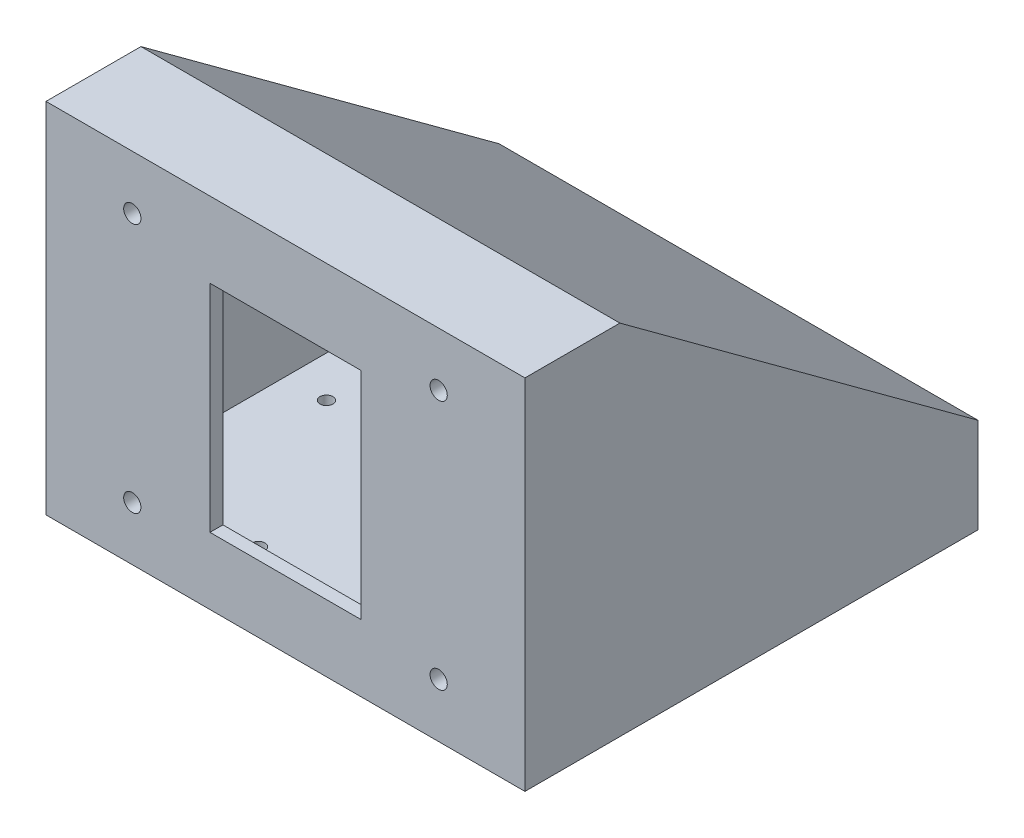
from build123d import *

# Parameters (mm, degrees)
SKETCH1_W           = 210
SKETCH1_H           = 210
SKETCH1_R           = 3
BOSS_EXTRUDE1_DEPTH = 6
SKETCH3_W           = 210
SKETCH3_H           = 6
BOSS_EXTRUDE2_DEPTH = 160
BOSS_EXTRUDE4_DEPTH = 6
BOSS_EXTRUDE5_START = -210
BOSS_EXTRUDE5_DEPTH = 6
SKETCH6_W           = 70
SKETCH6_H           = 100
CUT_EXTRUDE1_DEPTH  = 341.335128954
SKETCH7_W           = 210
SKETCH7_H           = 38
BOSS_EXTRUDE6_DEPTH = 6
SKETCH8_W           = 222
SKETCH8_H           = 206.009708509
BOSS_EXTRUDE7_DEPTH = 6
SKETCH9_W           = 222
SKETCH9_H           = 44
BOSS_EXTRUDE8_DEPTH = 6
CUT_EXTRUDE2_REACH  = 345.965
SKETCH10_R          = 4


with BuildPart() as part:
    # Sketch1 → Boss-Extrude1 (new body)
    with BuildSketch(Plane(origin=(0, 0, 0), x_dir=(1, 0, 0), z_dir=(0, 1, 0))):
        with Locations((105, 105)):
            Rectangle(SKETCH1_W, SKETCH1_H)
        with Locations((62, 179.478184725)):
            Circle(SKETCH1_R, mode=Mode.SUBTRACT)
        with Locations((148, 179.478184725)):
            Circle(SKETCH1_R, mode=Mode.SUBTRACT)
        with Locations((191, 105)):
            Circle(SKETCH1_R, mode=Mode.SUBTRACT)
        with Locations((148, 30.521815275)):
            Circle(SKETCH1_R, mode=Mode.SUBTRACT)
        with Locations((62, 30.521815275)):
            Circle(SKETCH1_R, mode=Mode.SUBTRACT)
        with Locations((19, 105)):
            Circle(SKETCH1_R, mode=Mode.SUBTRACT)
    extrude(amount=BOSS_EXTRUDE1_DEPTH)

    # Sketch3 → Boss-Extrude2 (add)
    with BuildSketch(Plane(origin=(0, 6, 0), x_dir=(1, 0, 0), z_dir=(0, 1, 0))):
        with Locations((105, 3)):
            Rectangle(SKETCH3_W, SKETCH3_H)
    extrude(amount=BOSS_EXTRUDE2_DEPTH)

    # Sketch4 → Boss-Extrude4 (add)
    with BuildSketch(Plane.ZY):
        Polygon((0, 0), (-210, 0), (-210, 44), (-44, 166), (0, 166), align=None)
    extrude(amount=BOSS_EXTRUDE4_DEPTH)

    # Sketch4<3> → Boss-Extrude5 (add)
    with BuildSketch(Plane.ZY.offset(BOSS_EXTRUDE5_START)):
        Polygon((0, 0), (-210, 0), (-210, 44), (-44, 166), (0, 166), align=None)
    extrude(amount=-BOSS_EXTRUDE5_DEPTH)

    # Sketch6 → Cut-Extrude1 (cut, through all)
    with BuildSketch(Plane(origin=(0, 0, -6), x_dir=(-1, 0, 0), z_dir=(0, 0, -1))):
        with Locations((-105, 81)):
            Rectangle(SKETCH6_W, SKETCH6_H)
    extrude(amount=-CUT_EXTRUDE1_DEPTH, mode=Mode.SUBTRACT)

    # Sketch7 → Boss-Extrude6 (add)
    with BuildSketch(Plane(origin=(0, 0, -210), x_dir=(-1, 0, 0), z_dir=(0, 0, -1))):
        with Locations((-105, 25)):
            Rectangle(SKETCH7_W, SKETCH7_H)
    extrude(amount=-BOSS_EXTRUDE6_DEPTH)

    # Sketch8 → Boss-Extrude7 (add)
    with BuildSketch(Plane(origin=(0, 128.779076343, -94.644863336), x_dir=(1, 0, 0), z_dir=(0, 0.8057872670242422, -0.5922050998611905))):
        with Locations((105, 40.153447427)):
            Rectangle(SKETCH8_W, SKETCH8_H)
    extrude(amount=-BOSS_EXTRUDE7_DEPTH)

    # Sketch9 → Boss-Extrude8 (add)
    with BuildSketch(Plane(origin=(0, 166, 0), x_dir=(1, 0, 0), z_dir=(0, 1, 0))):
        with Locations((105, 22)):
            Rectangle(SKETCH9_W, SKETCH9_H)
    extrude(amount=-BOSS_EXTRUDE8_DEPTH)

    # Sketch10 → Cut-Extrude2 (cut, up to next)
    with BuildSketch(Plane.XY, mode=Mode.PRIVATE) as cut_extrude2_sk1:
        with Locations((176, 141)):
            Circle(SKETCH10_R)
    cut_extrude2_tool1 = extrude(cut_extrude2_sk1.sketch, amount=-CUT_EXTRUDE2_REACH, mode=Mode.PRIVATE) & part.part
    # Sketch10 → Cut-Extrude2 (cut, up to next)
    with BuildSketch(Plane.XY, mode=Mode.PRIVATE) as cut_extrude2_sk2:
        with Locations((34, 141)):
            Circle(SKETCH10_R)
    cut_extrude2_tool2 = extrude(cut_extrude2_sk2.sketch, amount=-CUT_EXTRUDE2_REACH, mode=Mode.PRIVATE) & part.part
    # Sketch10 → Cut-Extrude2 (cut, up to next)
    with BuildSketch(Plane.XY, mode=Mode.PRIVATE) as cut_extrude2_sk3:
        with Locations((34, 25)):
            Circle(SKETCH10_R)
    cut_extrude2_tool3 = extrude(cut_extrude2_sk3.sketch, amount=-CUT_EXTRUDE2_REACH, mode=Mode.PRIVATE) & part.part
    # Sketch10 → Cut-Extrude2 (cut, up to next)
    with BuildSketch(Plane.XY, mode=Mode.PRIVATE) as cut_extrude2_sk4:
        with Locations((176, 25)):
            Circle(SKETCH10_R)
    cut_extrude2_tool4 = extrude(cut_extrude2_sk4.sketch, amount=-CUT_EXTRUDE2_REACH, mode=Mode.PRIVATE) & part.part
    add(cut_extrude2_tool1.solids().sort_by_distance((176, 141, 0))[0], mode=Mode.SUBTRACT)
    add(cut_extrude2_tool2.solids().sort_by_distance((34, 141, 0))[0], mode=Mode.SUBTRACT)
    add(cut_extrude2_tool3.solids().sort_by_distance((34, 25, 0))[0], mode=Mode.SUBTRACT)
    add(cut_extrude2_tool4.solids().sort_by_distance((176, 25, 0))[0], mode=Mode.SUBTRACT)


solid = part.part
